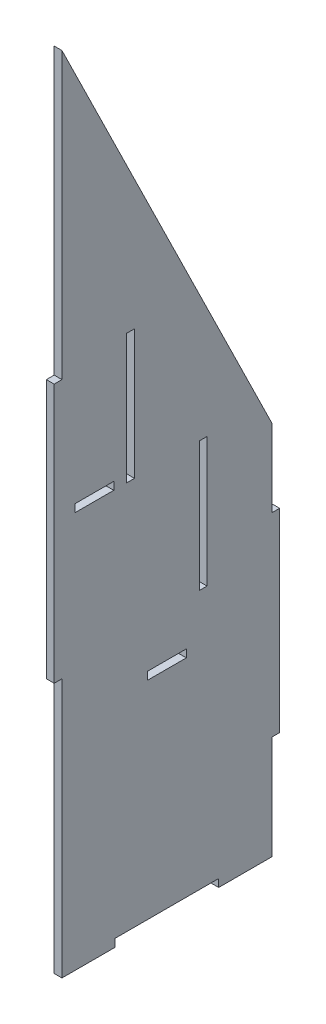
from build123d import *

# Parameters (mm, degrees)
SALIENTE_EXTRUIR1_DEPTH = 3
CROQUIS2_W              = 3
CROQUIS2_H              = 50
CORTAR_EXTRUIR2_DEPTH   = 70
CROQUIS4_W              = 15
CROQUIS4_H              = 3
CORTAR_EXTRUIR3_DEPTH   = 3


with BuildPart() as part:
    # Croquis1 → Saliente-Extruir1 (new body)
    with BuildSketch(Plane(origin=(0, 0, 0), x_dir=(0, 0, -1), z_dir=(1, 0, 0))):
        Polygon((0, 0), (0, 100), (-3, 100), (-3, 200), (0, 200), (0, 310), (81, 145), (81, 115), (84, 115), (84, 40), (81, 40), (81, 0), (60.5, 0), (60.5, 3), (20.5, 3), (20.5, 0), align=None)
    extrude(amount=SALIENTE_EXTRUIR1_DEPTH)

    # Croquis2 → Cortar-Extruir2 (cut)
    with BuildSketch(Plane(origin=(3, 0, 0), x_dir=(0, 0, -1), z_dir=(1, 0, 0))):
        with Locations((26.5, 178)):
            Rectangle(CROQUIS2_W, CROQUIS2_H)
        with Locations((54.5, 128)):
            Rectangle(CROQUIS2_W, CROQUIS2_H)
    extrude(amount=-CORTAR_EXTRUIR2_DEPTH, mode=Mode.SUBTRACT)

    # Croquis4 → Cortar-Extruir3 (cut)
    with BuildSketch(Plane(origin=(3, 0, 0), x_dir=(0, 0, -1), z_dir=(1, 0, 0))):
        with Locations((12.5, 154.5)):
            Rectangle(CROQUIS4_W, CROQUIS4_H)
        with Locations((40.5, 84.5)):
            Rectangle(CROQUIS4_W, CROQUIS4_H)
    extrude(amount=-CORTAR_EXTRUIR3_DEPTH, mode=Mode.SUBTRACT)


solid = part.part
